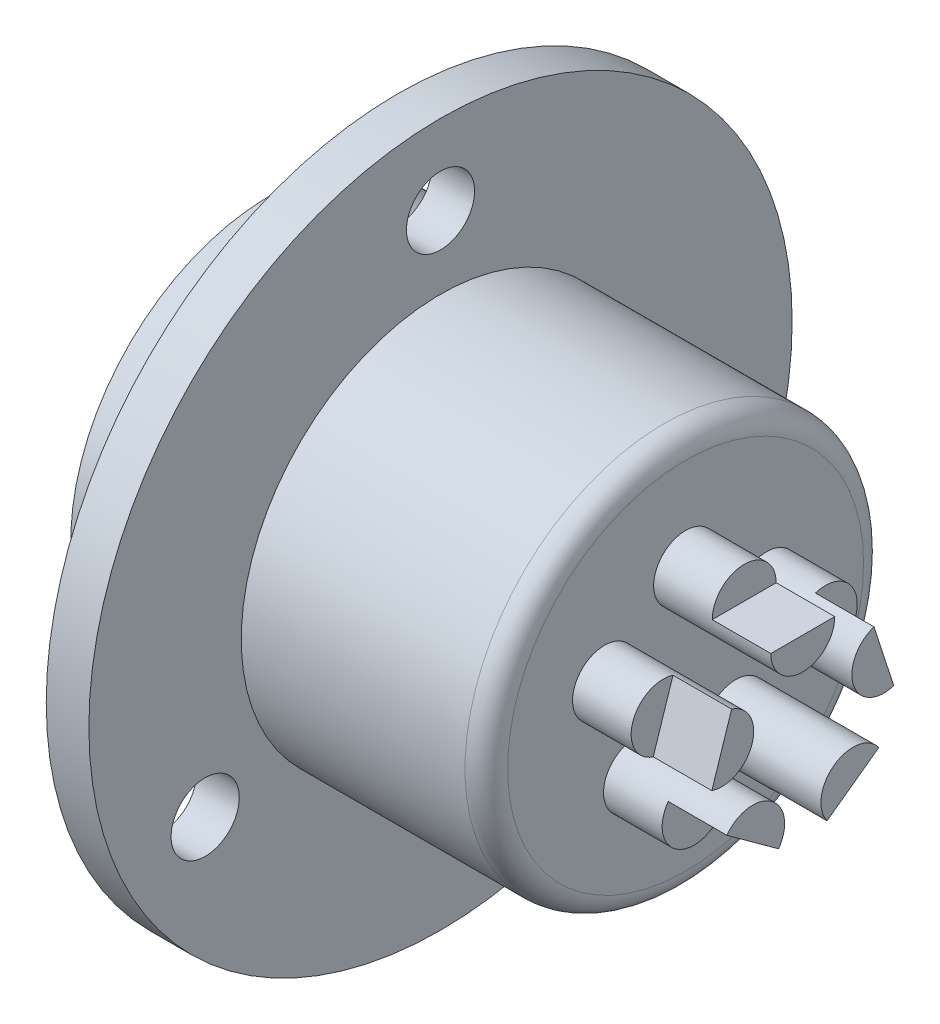
from build123d import *

# Parameters (mm, degrees)
SKIZZE2_R                       = 1.5
AUFSATZ_LINEAR_AUSTRAGEN1_DEPTH = 5.5
SKIZZE3_W                       = 2.75
SKIZZE3_H                       = 3
SCHNITT_LINEAR_AUSTRAGEN1_DEPTH = 1.5
KREISMUSTER1_COUNT              = 5
SKIZZE4_R                       = 1.6
SCHNITT_LINEAR_AUSTRAGEN5_DEPTH = 37.075926877
SKIZZE5_R                       = 8
SCHNITT_LINEAR_AUSTRAGEN6_DEPTH = 13
VERRUNDUNG1_R                   = 1


with BuildPart() as part:
    # Skizze1 → Rotation1 (revolve)
    with BuildSketch(Plane.XY):
        Polygon((0, 0), (6, 0), (6, 7.15), (8, 7.15), (8, 0), (19.5, 0), (19.5, -9.35), (0, -9.35), align=None)
    revolve(axis=Axis((19.5, -9.35, 0), (-1, 0, 0)))

    # Skizze2 → Aufsatz-Linear austragen1 (add)
    with BuildSketch(Plane.ZY.offset(-19.5)):
        with Locations((0, -5.35)):
            Circle(SKIZZE2_R)
    aufsatz_linear_austragen1 = extrude(amount=-AUFSATZ_LINEAR_AUSTRAGEN1_DEPTH)

    # Skizze3 → Schnitt-Linear austragen1 (cut)
    with BuildSketch(Plane(origin=(0, -3.85, 0), x_dir=(1, 0, 0), z_dir=(0, 1, 0))):
        with Locations((23.625, 0)):
            Rectangle(SKIZZE3_W, SKIZZE3_H)
    schnitt_linear_austragen1 = extrude(amount=-SCHNITT_LINEAR_AUSTRAGEN1_DEPTH, mode=Mode.SUBTRACT)

    # Kreismuster1: Aufsatz-Linear austragen1, Schnitt-Linear austragen1 ×5 about axis
    kreismuster1_axis = Axis((19.5, -9.35, 0), (1, 0, 0))
    add([aufsatz_linear_austragen1.rotate(kreismuster1_axis, i * 360 / KREISMUSTER1_COUNT) for i in range(1, KREISMUSTER1_COUNT)])
    add([schnitt_linear_austragen1.rotate(kreismuster1_axis, i * 360 / KREISMUSTER1_COUNT) for i in range(1, KREISMUSTER1_COUNT)], mode=Mode.SUBTRACT)

    # Skizze4 → Schnitt-Linear austragen5 (cut, through all)
    with BuildSketch(Plane(origin=(6, 0, 0), x_dir=(0, 0, -1), z_dir=(1, 0, 0))):
        with Locations((0, 3.4)):
            Circle(SKIZZE4_R)
        with Locations((11.041823898, -15.725)):
            Circle(SKIZZE4_R)
        with Locations((-11.041823898, -15.725)):
            Circle(SKIZZE4_R)
    extrude(amount=SCHNITT_LINEAR_AUSTRAGEN5_DEPTH, mode=Mode.SUBTRACT)

    # Skizze5 → Schnitt-Linear austragen6 (cut)
    with BuildSketch(Plane.ZY):
        with Locations((0, -9.35)):
            Circle(SKIZZE5_R)
    extrude(amount=-SCHNITT_LINEAR_AUSTRAGEN6_DEPTH, mode=Mode.SUBTRACT)

    # Verrundung1
    verrundung1_edges = [part.edges().sort_by_distance(p)[0] for p in [
        (19.5, -18.7, 0),
    ]]
    fillet(verrundung1_edges, radius=VERRUNDUNG1_R)


solid = part.part
